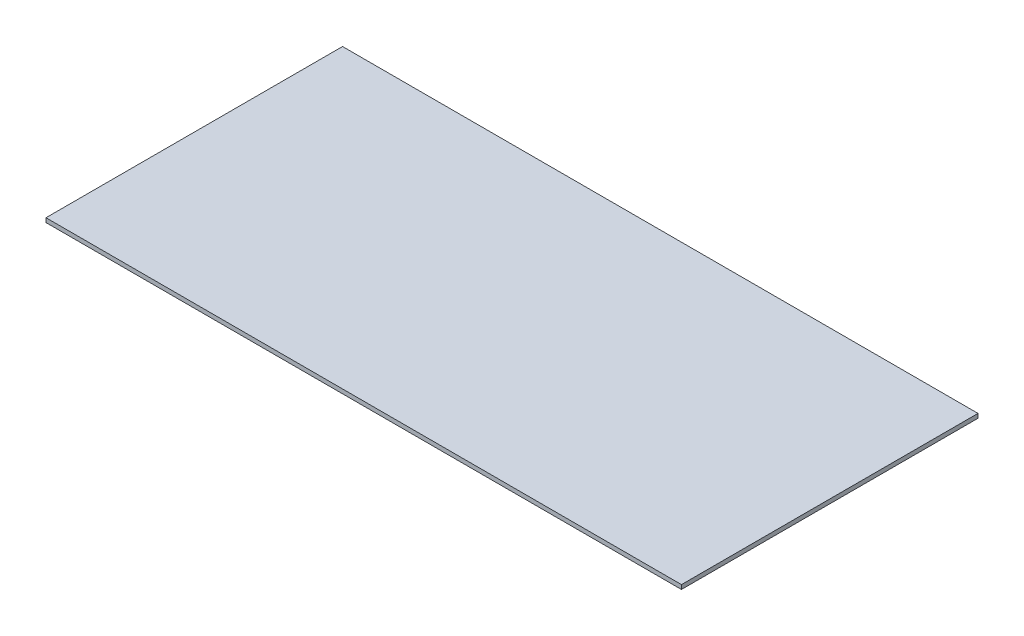
from build123d import *

# Parameters (mm, degrees)
SKETCH_1_W      = 900
SKETCH_1_H      = 6
EXTRUDE_1_DEPTH = 420


with BuildPart() as part:
    # 草图1 → 凸台-拉伸1 (new body)
    with BuildSketch(Plane.XY):
        Rectangle(SKETCH_1_W, SKETCH_1_H)
    extrude(amount=EXTRUDE_1_DEPTH)


solid = part.part
